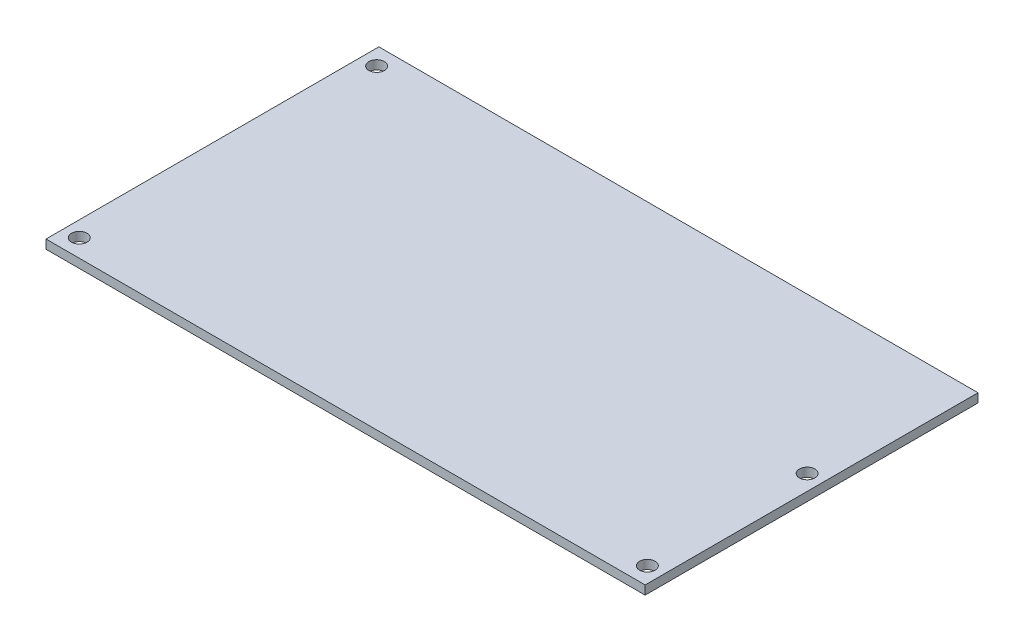
from build123d import *

# Parameters (mm, degrees)
SKETCH_1_W        = 135
SKETCH_1_H        = 75
SKETCH_1_R        = 1.75
EXTRUDE_372_DEPTH = 2


with BuildPart() as part:
    # Эскиз1 → Extrude 372 (new body)
    with BuildSketch(Plane(origin=(0, 0, 0), x_dir=(1, 0, 0), z_dir=(0, 1, 0))):
        Rectangle(SKETCH_1_W, SKETCH_1_H)
        with Locations(Location((-64, -33.5, 0), (0, 0, 270))):
            Circle(SKETCH_1_R, mode=Mode.SUBTRACT)
        with Locations(Location((-64, 33.5, 0), (0, 0, 270))):
            Circle(SKETCH_1_R, mode=Mode.SUBTRACT)
        with Locations(Location((64, -33.5, 0), (0, 0, 270))):
            Circle(SKETCH_1_R, mode=Mode.SUBTRACT)
        with Locations(Location((64, 2.5, 0), (0, 0, 270))):
            Circle(SKETCH_1_R, mode=Mode.SUBTRACT)
    extrude(amount=EXTRUDE_372_DEPTH)


solid = part.part
